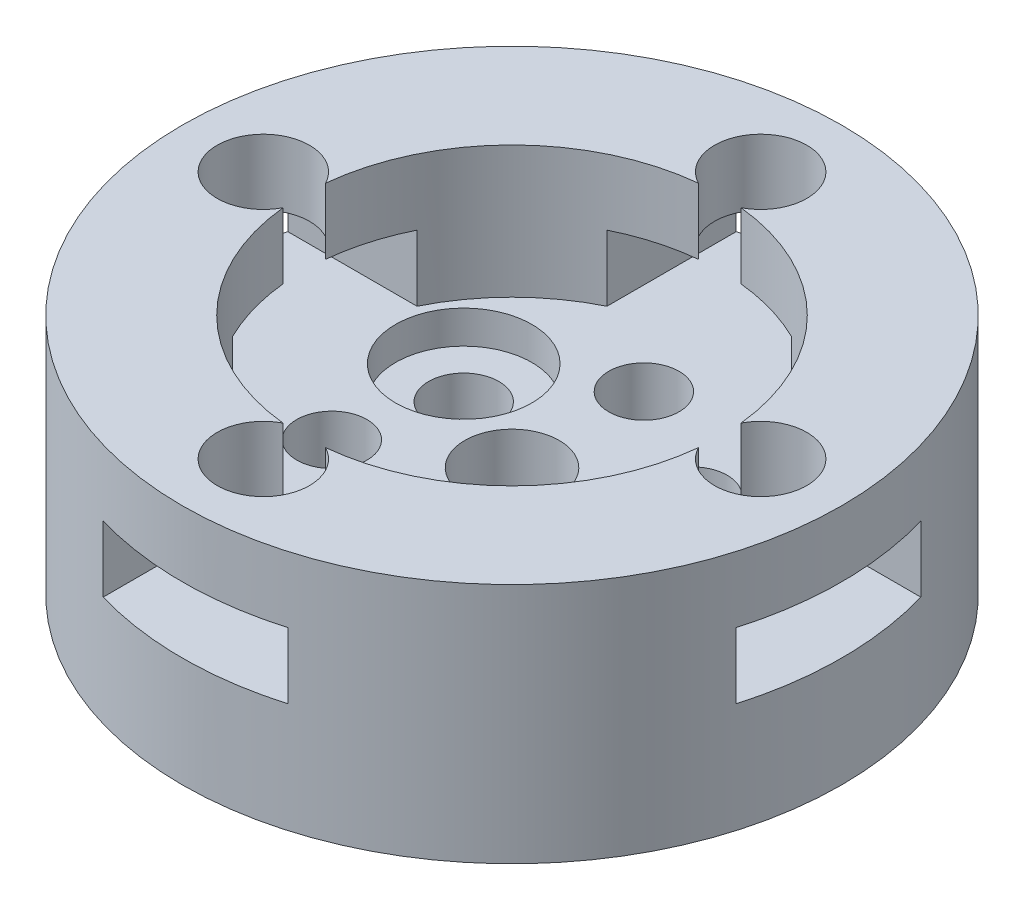
from build123d import *

# Parameters (mm, degrees)
SKETCH1_R           = 10
SKETCH1_R_2         = 1.6
SKETCH1_R_3         = 2.15
BOSS_EXTRUDE1_DEPTH = 5
SKETCH2_R           = 3.1
CUT_EXTRUDE2_DEPTH  = 1.5
SKETCH3_R           = 15
SKETCH3_R_2         = 9.5
BOSS_EXTRUDE2_DEPTH = 11
SKETCH5_R           = 2.1
CUT_EXTRUDE3_DEPTH  = 3
SKETCH7_W           = 10
SKETCH7_H           = 8.4
SKETCH7_W_2         = 8.4
SKETCH7_H_2         = 10
CUT_EXTRUDE4_DEPTH  = 3


with BuildPart() as part:
    # Sketch1 → Boss-Extrude1 (new body)
    with BuildSketch(Plane(origin=(0, 0, 0), x_dir=(1, 0, 0), z_dir=(0, 1, 0))):
        with Locations(Location((0, 0, 0), (0, 0, 270))):
            Circle(SKETCH1_R)
        with Locations(Location((0, 6, 0), (0, 0, 270))):
            Circle(SKETCH1_R_2, mode=Mode.SUBTRACT)
        with Locations(Location((5.196152423, 3, 0), (0, 0, 270))):
            Circle(SKETCH1_R_2, mode=Mode.SUBTRACT)
        with Locations(Location((5.196152423, -3, 0), (0, 0, 270))):
            Circle(SKETCH1_R_2, mode=Mode.SUBTRACT)
        with Locations(Location((0, -6, 0), (0, 0, 270))):
            Circle(SKETCH1_R_2, mode=Mode.SUBTRACT)
        with Locations(Location((-5.196152423, -3, 0), (0, 0, 270))):
            Circle(SKETCH1_R_2, mode=Mode.SUBTRACT)
        with Locations(Location((-5.196152423, 3, 0), (0, 0, 270))):
            Circle(SKETCH1_R_2, mode=Mode.SUBTRACT)
        with Locations(Location((0, 0, 0), (0, 0, 270))):
            Circle(SKETCH1_R_3, mode=Mode.SUBTRACT)
    extrude(amount=BOSS_EXTRUDE1_DEPTH)

    # Sketch2 → Cut-Extrude2 (cut)
    with BuildSketch(Plane(origin=(0, 5, 0), x_dir=(1, 0, 0), z_dir=(0, 1, 0))):
        with Locations(Location((-5.196152423, 3, 0), (0, 0, 270))):
            Circle(SKETCH2_R)
        with Locations(Location((5.196152423, -3, 0), (0, 0, 270))):
            Circle(SKETCH2_R)
    extrude(amount=-CUT_EXTRUDE2_DEPTH, mode=Mode.SUBTRACT)

    # Sketch3 → Boss-Extrude2 (add)
    with BuildSketch(Plane.XZ):
        with Locations(Location((0, 0, 0), (0, 0, 270))):
            Circle(SKETCH3_R)
        with Locations(Location((0, 0, 0), (0, 0, 270))):
            Circle(SKETCH3_R_2, mode=Mode.SUBTRACT)
    extrude(amount=-BOSS_EXTRUDE2_DEPTH)

    # Sketch5 → Cut-Extrude3 (cut)
    with BuildSketch(Plane(origin=(0, 11, 0), x_dir=(1, 0, 0), z_dir=(0, 1, 0))):
        with Locations((0, 11.313708499)):
            Circle(SKETCH5_R)
        with Locations((11.313708499, 0)):
            Circle(SKETCH5_R)
        with Locations((0, -11.313708499)):
            Circle(SKETCH5_R)
        with Locations((-11.313708499, 0)):
            Circle(SKETCH5_R)
    extrude(amount=-CUT_EXTRUDE3_DEPTH, mode=Mode.SUBTRACT)

    # Sketch7 → Cut-Extrude4 (cut)
    with BuildSketch(Plane(origin=(0, 8, 0), x_dir=(1, 0, 0), z_dir=(0, 1, 0))):
        with Locations((-12.313708499, 0)):
            Rectangle(SKETCH7_W, SKETCH7_H)
        with Locations((0, 12.313708499)):
            Rectangle(SKETCH7_W_2, SKETCH7_H_2)
        with Locations((12.313708499, 0)):
            Rectangle(SKETCH7_W, SKETCH7_H)
        with Locations((0, -12.313708499)):
            Rectangle(SKETCH7_W_2, SKETCH7_H_2)
    extrude(amount=-CUT_EXTRUDE4_DEPTH, mode=Mode.SUBTRACT)


solid = part.part
